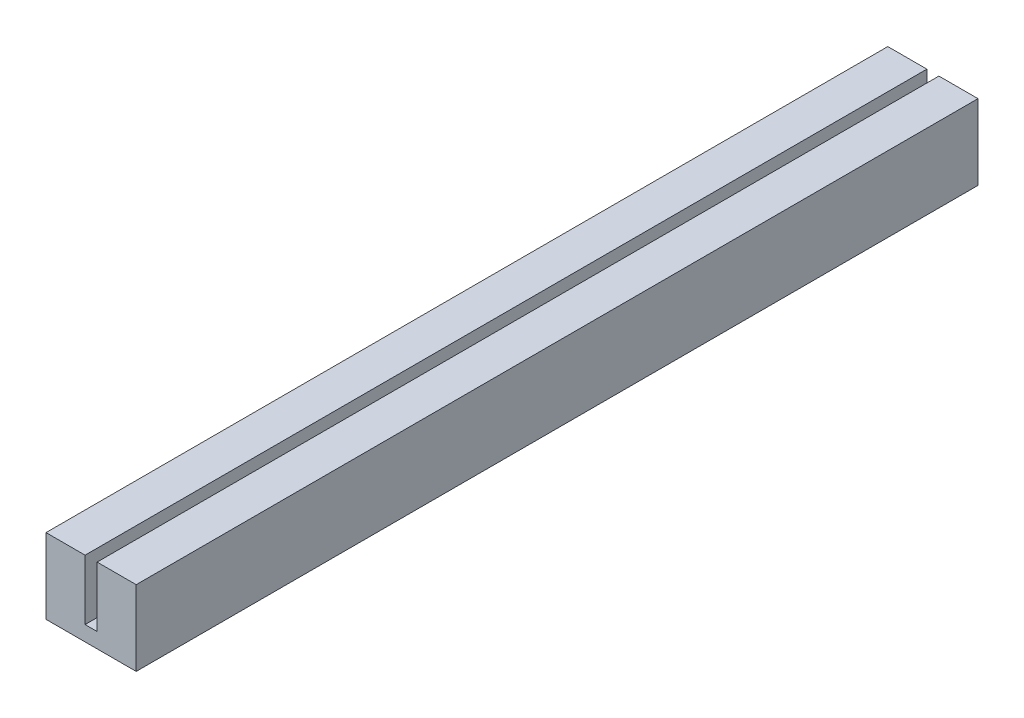
from build123d import *

# Parameters (mm, degrees)
SKETCH_1_W      = 30
SKETCH_1_H      = 280
EXTRUDE_1_DEPTH = 5
SKETCH_2_W      = 13
SKETCH_2_H      = 280
EXTRUDE_2_DEPTH = 20


with BuildPart() as part:
    # 草图1 → 凸台-拉伸1 (new body)
    with BuildSketch(Plane(origin=(0, 0, 0), x_dir=(1, 0, 0), z_dir=(0, 1, 0))):
        with Locations((15, -93.34585106)):
            Rectangle(SKETCH_1_W, SKETCH_1_H)
    extrude(amount=-EXTRUDE_1_DEPTH)

    # 草图2 → 凸台-拉伸2 (add)
    with BuildSketch(Plane(origin=(0, 0, 0), x_dir=(1, 0, 0), z_dir=(0, 1, 0))):
        with Locations((6.5, -93.34585106)):
            Rectangle(SKETCH_2_W, SKETCH_2_H)
        with Locations((23.5, -93.34585106)):
            Rectangle(SKETCH_2_W, SKETCH_2_H)
    extrude(amount=EXTRUDE_2_DEPTH)


solid = part.part
